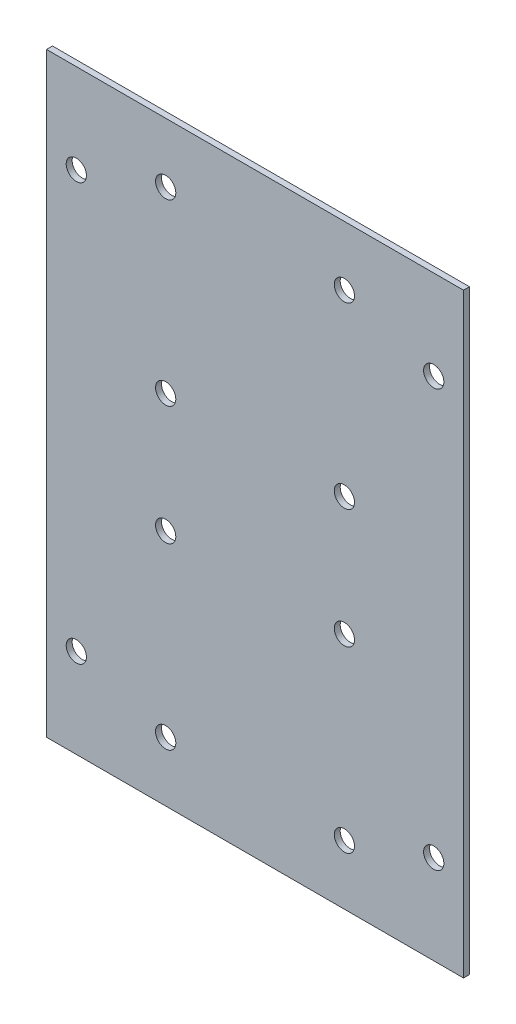
from build123d import *

# Parameters (mm, degrees)
SKETCH1_W               = 70
SKETCH1_H               = 100
BOSS_EXTRUDE1_DEPTH     = 1
CUT_EXTRUDE1_DEPTH      = 62.040969848
CUT_EXTRUDE1_DEPTH_BACK = 62.040969848
SKETCH2_R               = 1.7


with BuildPart() as part:
    # Sketch1 → Boss-Extrude1 (new body)
    with BuildSketch(Plane.XY):
        Rectangle(SKETCH1_W, SKETCH1_H)
    extrude(amount=-BOSS_EXTRUDE1_DEPTH)

    # Sketch2 → Cut-Extrude1 (cut, two sides: drawn at the far end of the back side and taken through both)
    with BuildSketch(Plane.XY.offset(-CUT_EXTRUDE1_DEPTH_BACK)):
        with Locations((-30, -35)):
            Circle(SKETCH2_R)
        with Locations((-30, 35)):
            Circle(SKETCH2_R)
        with Locations((30, -35)):
            Circle(SKETCH2_R)
        with Locations((30, 35)):
            Circle(SKETCH2_R)
        with Locations((-15, -40)):
            Circle(SKETCH2_R)
        with Locations((-15, -10)):
            Circle(SKETCH2_R)
        with Locations((-15, 10)):
            Circle(SKETCH2_R)
        with Locations((-15, 40)):
            Circle(SKETCH2_R)
        with Locations((15, -40)):
            Circle(SKETCH2_R)
        with Locations((15, -10)):
            Circle(SKETCH2_R)
        with Locations((15, 10)):
            Circle(SKETCH2_R)
        with Locations((15, 40)):
            Circle(SKETCH2_R)
    extrude(amount=CUT_EXTRUDE1_DEPTH + CUT_EXTRUDE1_DEPTH_BACK, mode=Mode.SUBTRACT)


solid = part.part
